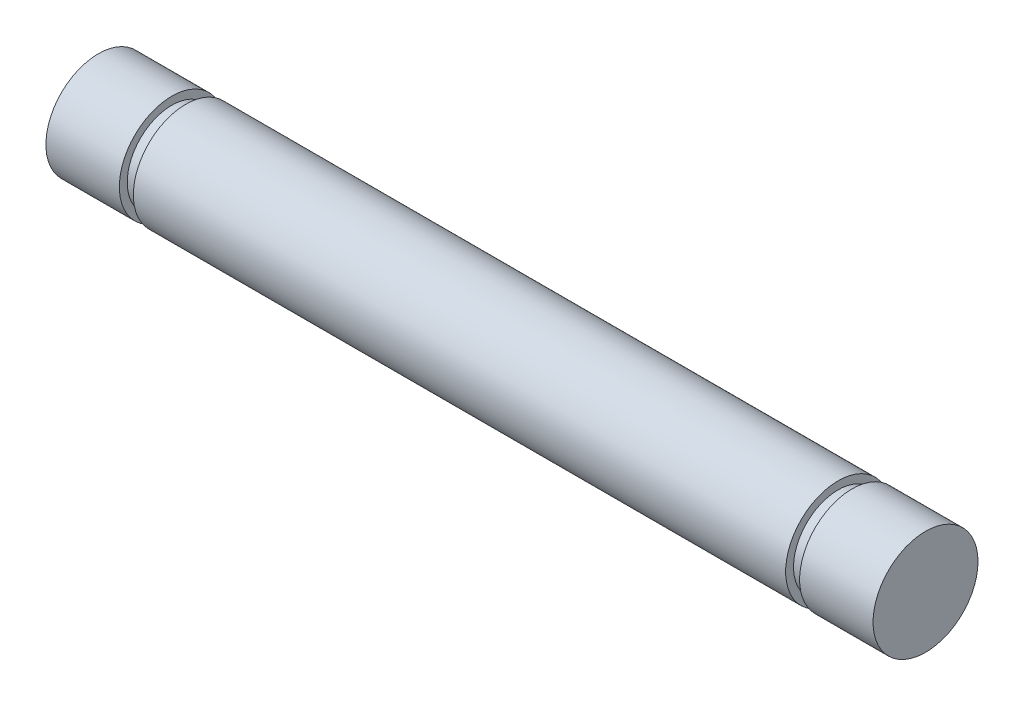
from build123d import *


with BuildPart() as part:
    # Croquis1 → Revolución1 (revolve)
    with BuildSketch(Plane(origin=(0, 0, 0), x_dir=(-1, 0, 0), z_dir=(0, 1, 0)), mode=Mode.PRIVATE) as revoluci_n1_sk:
        Polygon((-18.65, 3), (18.65, 3), (18.65, 2.55), (19.45, 2.55), (19.45, 3), (23.65, 3), (23.65, 0), (-23.65, 0), (-23.65, 3), (-19.45, 3), (-19.45, 2.55), (-18.65, 2.55), align=None)
    revolve(revoluci_n1_sk.sketch.rotate(Axis((23.65, 0, 0), (-1, 0, 0)), 180), axis=Axis((23.65, 0, 0), (-1, 0, 0)))


solid = part.part
